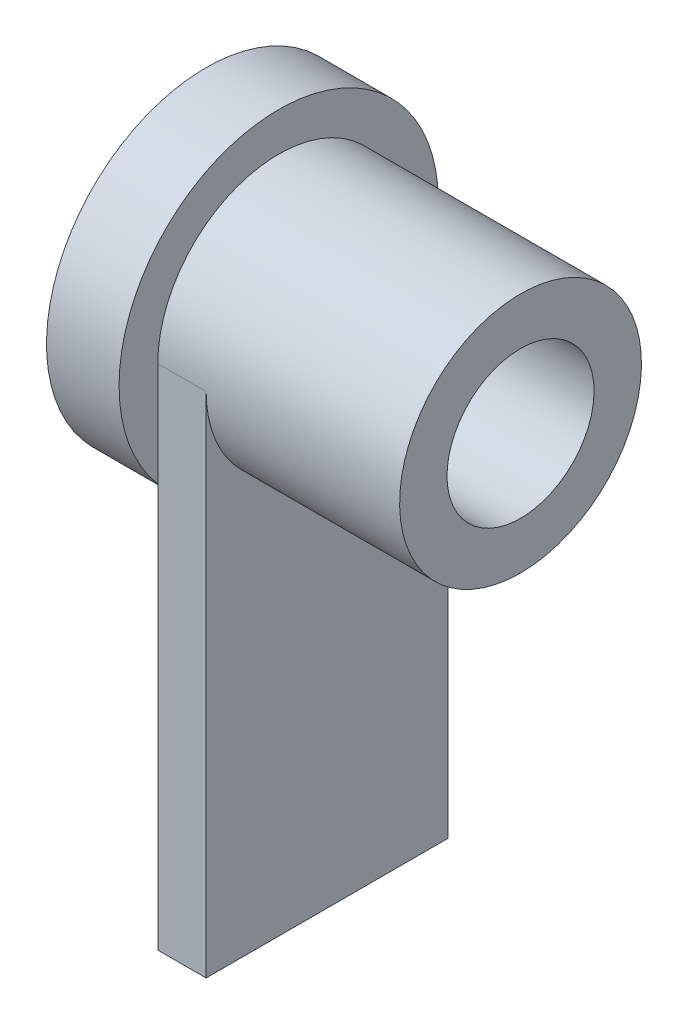
from build123d import *

# Parameters (mm, degrees)
SKETCH1_W           = 6.35
SKETCH1_H           = 66.675
BOSS_EXTRUDE1_DEPTH = 15.875
SKETCH2_R           = 15.875
BOSS_EXTRUDE2_DEPTH = 31.75
SKETCH3_R           = 20.955
BOSS_EXTRUDE3_DEPTH = 9.525


with BuildPart() as part:
    # Sketch1 → Boss-Extrude1 (new, symmetric)
    with BuildSketch(Plane.XY):
        with Locations((3.175, -33.3375)):
            Rectangle(SKETCH1_W, SKETCH1_H)
    extrude(amount=BOSS_EXTRUDE1_DEPTH, both=True)

    # Sketch2 → Boss-Extrude2 (add)
    with BuildSketch(Plane.ZY):
        with Locations(Location((0, 0, 0), (0, 0, 270))):
            Circle(SKETCH2_R)
    extrude(amount=-BOSS_EXTRUDE2_DEPTH)

    # Sketch3 → Boss-Extrude3 (add)
    with BuildSketch(Plane.ZY):
        with Locations(Location((0, 0, 0), (0, 0, 220.749054377))):
            Circle(SKETCH3_R)
    extrude(amount=BOSS_EXTRUDE3_DEPTH)

    # Sketch4 → Cut-Revolve1 (revolve, cut)
    with BuildSketch(Plane.XY):
        Polygon((-9.525, 19.1135), (-6.35, 19.1135), (-6.35, 9.652), (31.75, 9.652), (31.75, 0), (-9.525, 0), align=None)
    revolve(axis=Axis((31.75, 0, 0), (-1, 0, 0)), mode=Mode.SUBTRACT)


solid = part.part
